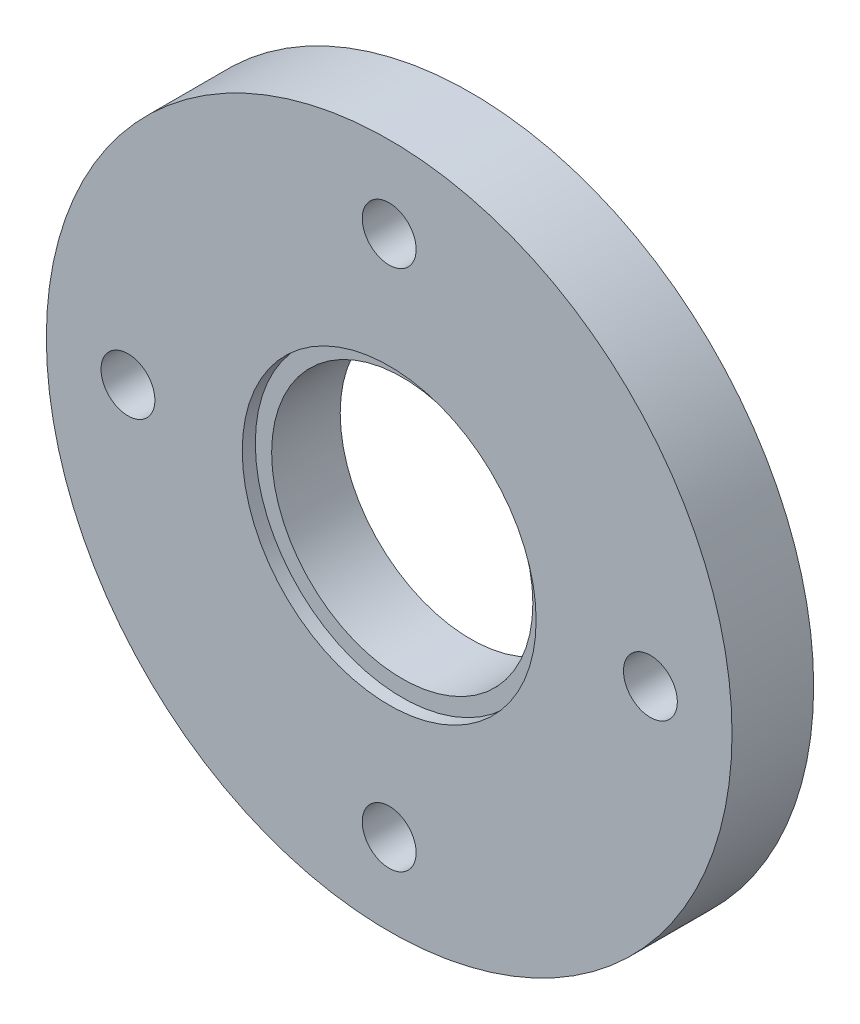
from build123d import *

# Parameters (mm, degrees)
SKETCH_1_R          = 21
SKETCH_1_R_2        = 8
EXTRUDE_1_DEPTH     = 5
M4X0_71_D           = 3.3
SKETCH_4_R          = 9
CUT_EXTRUDE_1_DEPTH = 0.8


with BuildPart() as part:
    # Эскиз1 → Бобышка-Вытянуть1 (new body)
    with BuildSketch(Plane.XY):
        Circle(SKETCH_1_R)
        Circle(SKETCH_1_R_2, mode=Mode.SUBTRACT)
    extrude(amount=EXTRUDE_1_DEPTH)

    # Отверстие обработанное метчиком M4x0.71 (through all)
    with Locations(Plane.XY.offset(5)):
        with Locations((0, 16), (-16, 0), (0, -16), (16, 0)):
            Hole(M4X0_71_D / 2)

    # Эскиз4 → Вырез-Вытянуть1 (cut)
    with BuildSketch(Plane.XY.offset(5)):
        Circle(SKETCH_4_R)
    extrude(amount=-CUT_EXTRUDE_1_DEPTH, mode=Mode.SUBTRACT)


solid = part.part
